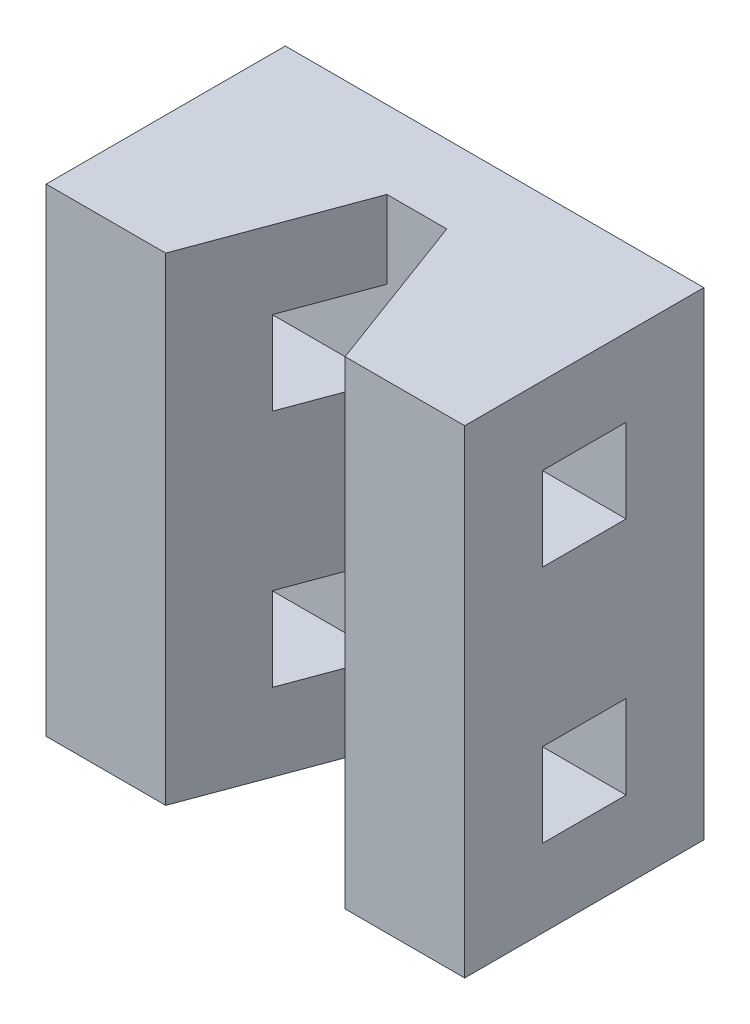
from build123d import *

# Parameters (mm, degrees)
ESBO_O1_W                = 14
ESBO_O1_H                = 16
RESSALTO_EXTRUS_O1_DEPTH = 8
ESBO_O3_W                = 2.8
ESBO_O3_H                = 2.8
CORTE_EXTRUS_O2_DEPTH    = 19
CORTE_EXTRUS_O3_DEPTH    = 20.209372712


with BuildPart() as part:
    # Esboço1 → Ressalto-extrusão1 (new body)
    with BuildSketch(Plane.XY):
        Rectangle(ESBO_O1_W, ESBO_O1_H)
    extrude(amount=RESSALTO_EXTRUS_O1_DEPTH)

    # Esboço3 → Corte-extrusão2 (cut, through all)
    with BuildSketch(Plane(origin=(7, 0, 0), x_dir=(0, 0, -1), z_dir=(1, 0, 0))):
        with Locations((-4, 4)):
            Rectangle(ESBO_O3_W, ESBO_O3_H)
        with Locations((-4, -4)):
            Rectangle(ESBO_O3_W, ESBO_O3_H)
    extrude(amount=-CORTE_EXTRUS_O2_DEPTH, mode=Mode.SUBTRACT)

    # Esboço5 → Corte-extrusão3 (cut, through all)
    with BuildSketch(Plane(origin=(0, 8, 0), x_dir=(1, 0, 0), z_dir=(0, 1, 0))):
        Polygon((-1, -2.6), (-3, -8), (3, -8), (1, -2.6), align=None)
    extrude(amount=-CORTE_EXTRUS_O3_DEPTH, mode=Mode.SUBTRACT)


solid = part.part
